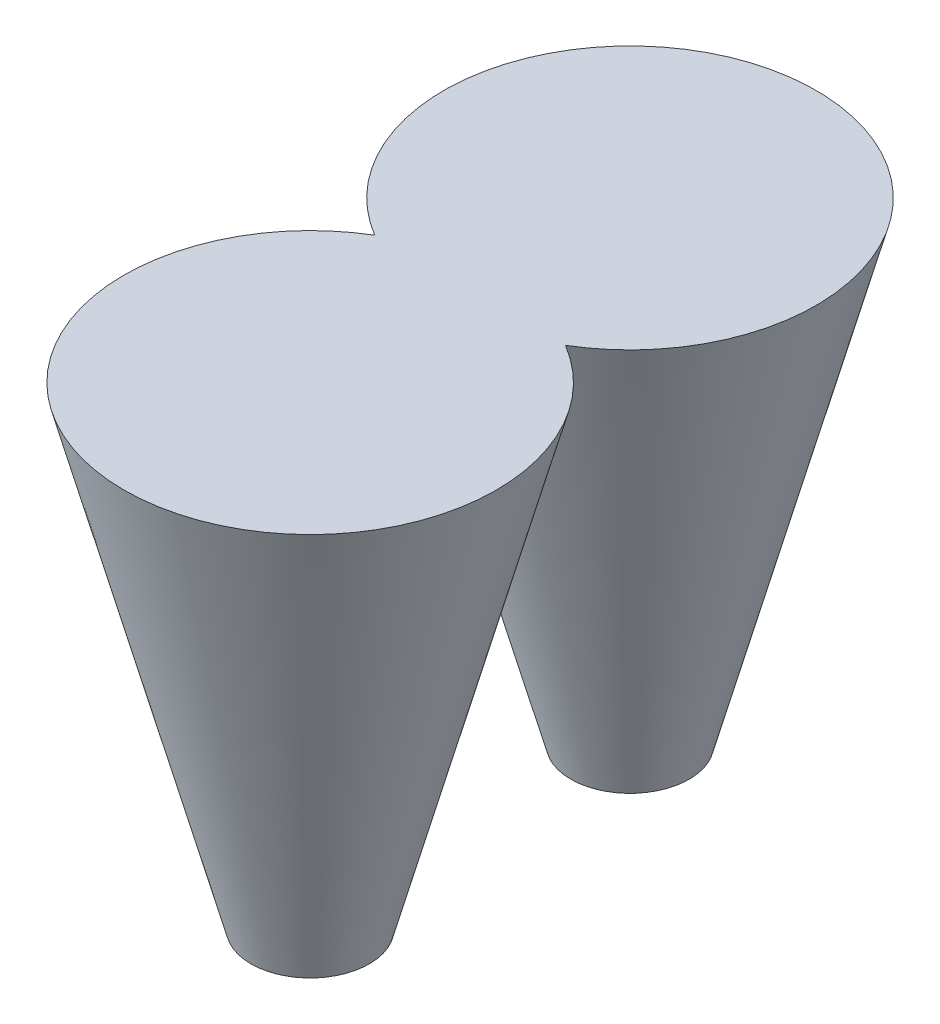
from build123d import *

# Parameters (mm, degrees)
ESBO_O1_R                = 500
RESSALTO_EXTRUS_O1_DEPTH = 4000
RESSALTO_EXTRUS_O1_TAPER = -15


with BuildPart() as part:
    # Esboço1 → Ressalto-extrusão1 (new body)
    with BuildSketch(Plane(origin=(0, 0, 0), x_dir=(1, 0, 0), z_dir=(0, 1, 0))):
        with Locations((-4000, -550)):
            Circle(ESBO_O1_R)
        with Locations((-4000, 2150)):
            Circle(ESBO_O1_R)
    extrude(amount=RESSALTO_EXTRUS_O1_DEPTH, taper=RESSALTO_EXTRUS_O1_TAPER)


solid = part.part
